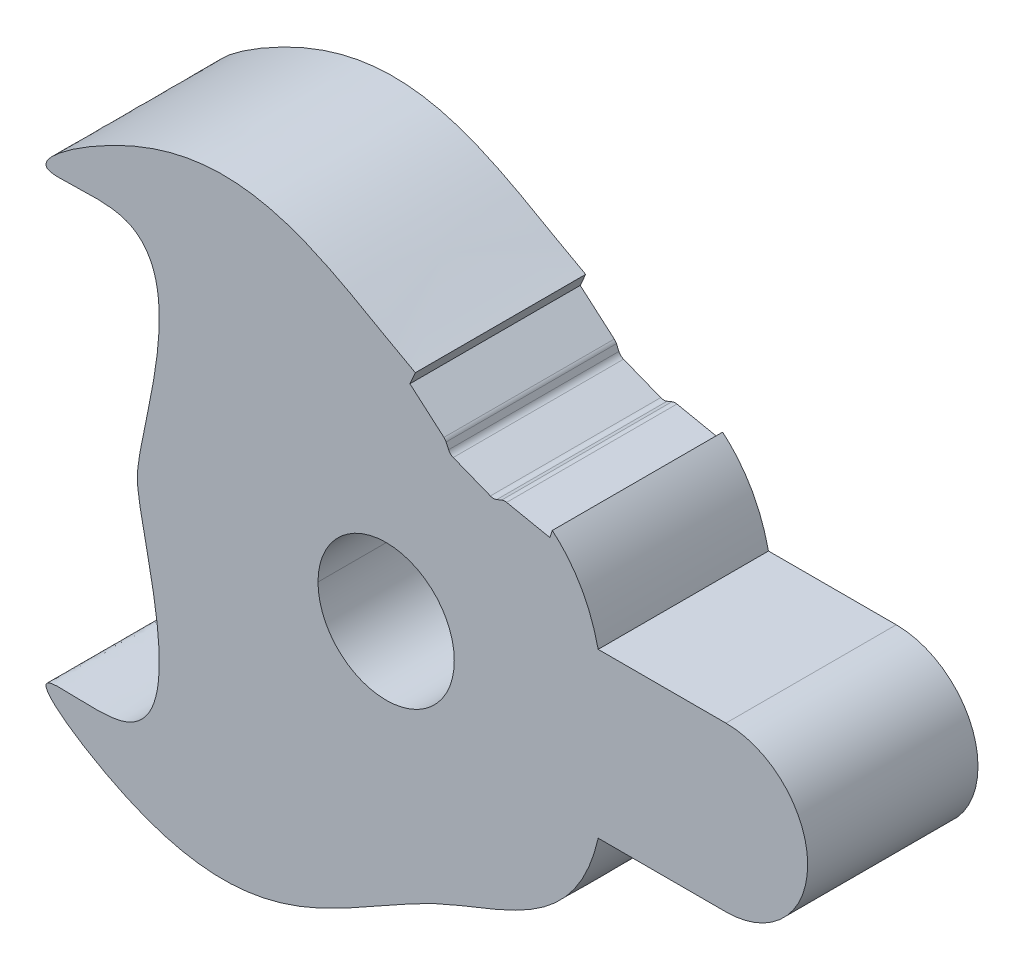
from build123d import *

# Parameters (mm, degrees)
BOSS_EXTRUDE1_DEPTH = 10
CUT_EXTRUDE1_DEPTH  = 79.575317599
FILLET1_R           = 1


with BuildPart() as part:
    # Sketch1 → Boss-Extrude1 (new, symmetric)
    with BuildSketch(Plane.XY):
        with BuildLine():
            Line((42.41, 9.6), (57.41, 9.6))
            ThreePointArc((57.41, 9.6), (64.198225099, 6.788225099), (67.01, 0))
            Line((67.01, 0), (25.509975, 0))
            ThreePointArc((25.509975, 0), (17.51, 8.02), (9.510025, 0))
            Line((9.510025, 0), (-11.692847795, 0))
            add(Edge.make_bspline(
                [(-11.692847795, 0), (-11.839277844, 4.894472382), (-2.355638504, 29.349990567), (-27.884479131, 24.143418291), (0.622804196, 43.544116676), (18.660438136, 24.200061232), (39.858672244, 20.776037443), (42.41, 9.6)],
                knots=[0, 0, 0, 0, 0.241029233, 0.319956468, 0.433187218, 0.773178915, 1, 1, 1, 1], degree=3))
        make_face()
    boss_extrude1 = extrude(amount=BOSS_EXTRUDE1_DEPTH, both=True)

    # Mirror1: Boss-Extrude1 across plane
    add(boss_extrude1.mirror(Plane(origin=(67.01, 0, 10), x_dir=(0, 0, 1), z_dir=(0, 1, 0))))

    # Sketch2 → Cut-Extrude1 (cut, through all)
    with BuildSketch(Plane.XY.offset(10)):
        Polygon((37.599990858, 20.829982635), (36.745669015, 18.129982635), (31.357199334, 19.231978325), (30.127412175, 18.724046173), (25.012165, 20.744998013), (24.461623313, 21.956309443), (20.301173919, 25.553622446), (20.939990858, 26.998722068), align=None)
    extrude(amount=-CUT_EXTRUDE1_DEPTH, mode=Mode.SUBTRACT)

    # Fillet1
    fillet1_edges = [part.edges().sort_by_distance(p)[0] for p in [
        (31.357199334, 19.231978325, 0),
        (30.127412175, 18.724046173, 0),
        (25.012165, 20.744998013, 0),
        (24.461623313, 21.956309443, 0),
    ]]
    fillet(fillet1_edges, radius=FILLET1_R)


solid = part.part
